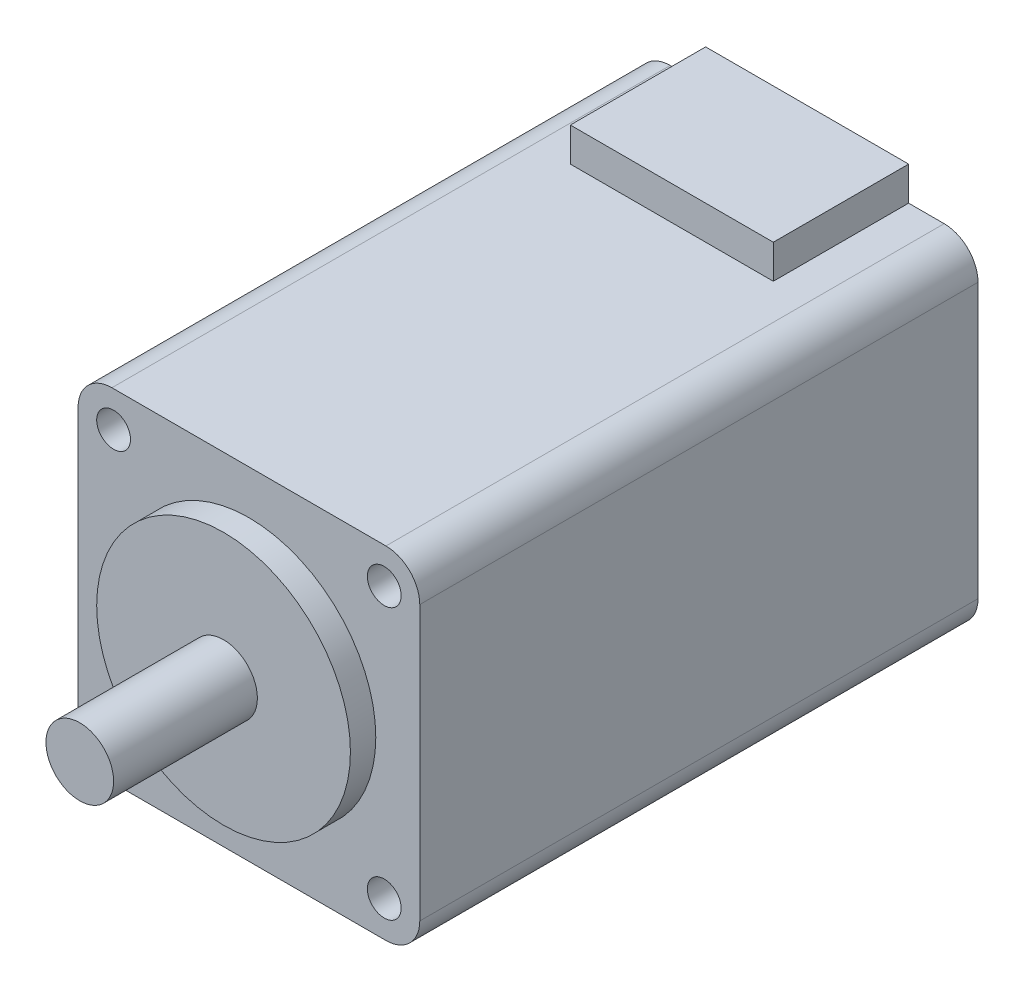
from build123d import *

# Parameters (mm, degrees)
BOSS_EXTRUDE1_DEPTH = 33
SKETCH2_R           = 1
CUT_EXTRUDE1_DEPTH  = 3.5
SKETCH3_W           = 12
SKETCH3_H           = 2
BOSS_EXTRUDE2_DEPTH = 8
SKETCH4_R           = 7.5
BOSS_EXTRUDE3_DEPTH = 1.5
SKETCH5_R           = 2
BOSS_EXTRUDE4_DEPTH = 8.5


with BuildPart() as part:
    # Sketch1 → Boss-Extrude1 (new body)
    with BuildSketch(Plane.XY):
        with BuildLine():
            Line((-8.1, -10.1), (8.1, -10.1))
            ThreePointArc((8.1, -10.1), (9.514213562, -9.514213562), (10.1, -8.1))
            Line((10.1, -8.1), (10.1, 8.1))
            ThreePointArc((10.1, 8.1), (9.514213562, 9.514213562), (8.1, 10.1))
            Line((8.1, 10.1), (-8.1, 10.1))
            ThreePointArc((-8.1, 10.1), (-9.514213562, 9.514213562), (-10.1, 8.1))
            Line((-10.1, 8.1), (-10.1, -8.1))
            ThreePointArc((-10.1, -8.1), (-9.514213562, -9.514213562), (-8.1, -10.1))
        make_face()
    extrude(amount=-BOSS_EXTRUDE1_DEPTH)

    # Sketch2 → Cut-Extrude1 (cut)
    with BuildSketch(Plane.XY):
        with Locations((-8, 8)):
            Circle(SKETCH2_R)
        with Locations((8, 8)):
            Circle(SKETCH2_R)
        with Locations((8, -8)):
            Circle(SKETCH2_R)
        with Locations((-8, -8)):
            Circle(SKETCH2_R)
    extrude(amount=-CUT_EXTRUDE1_DEPTH, mode=Mode.SUBTRACT)

    # Sketch3 → Boss-Extrude2 (add)
    with BuildSketch(Plane(origin=(0, 0, -33), x_dir=(-1, 0, 0), z_dir=(0, 0, -1))):
        with Locations((0, 11.1)):
            Rectangle(SKETCH3_W, SKETCH3_H)
    extrude(amount=-BOSS_EXTRUDE2_DEPTH)

    # Sketch4 → Boss-Extrude3 (add)
    with BuildSketch(Plane.XY):
        with Locations(Location((0, 0, 0), (0, 0, 180))):
            Circle(SKETCH4_R)
    extrude(amount=BOSS_EXTRUDE3_DEPTH)

    # Sketch5 → Boss-Extrude4 (add)
    with BuildSketch(Plane.XY.offset(1.5)):
        Circle(SKETCH5_R)
    extrude(amount=BOSS_EXTRUDE4_DEPTH)


solid = part.part
